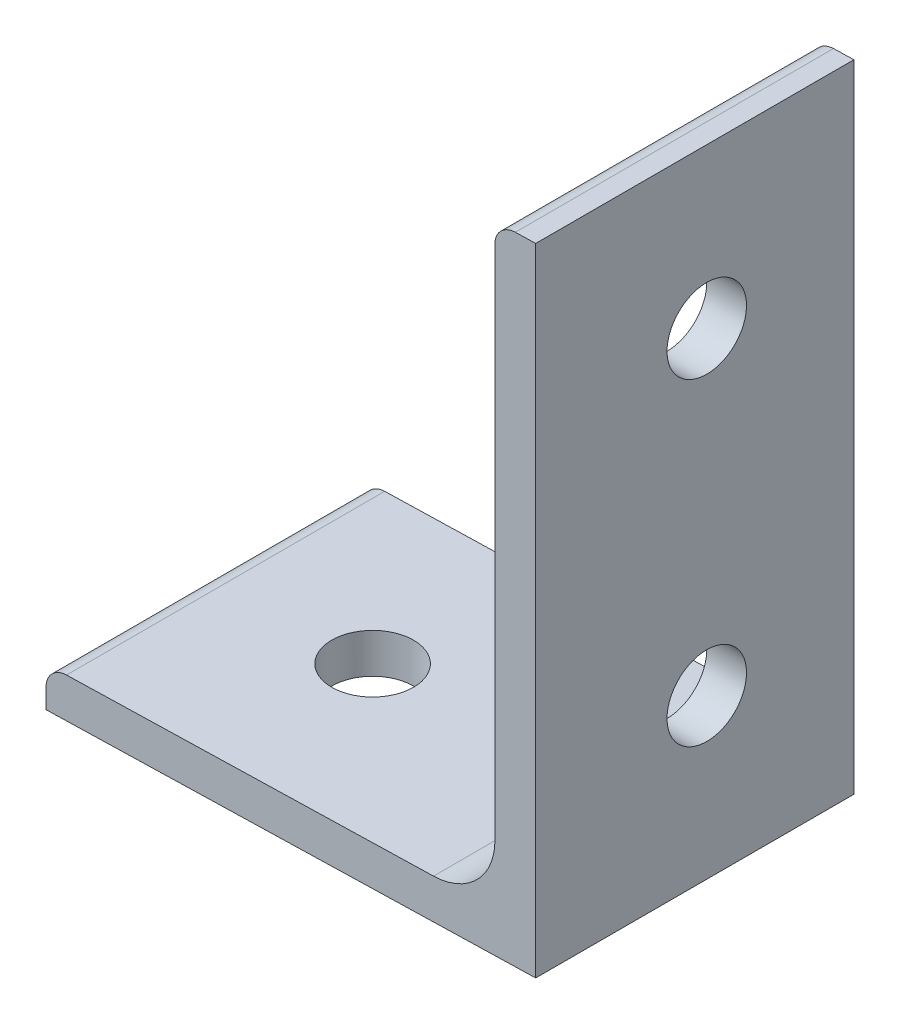
from build123d import *

# Parameters (mm, degrees)
BOSS_EXTRUDE1_DEPTH     = 15.875
SKETCH4_R               = 3.175
CUT_EXTRUDE1_DEPTH      = 49.464271634
SKETCH3_OUTSIDE_W       = 54.3
SKETCH3_OUTSIDE_H       = 47.95
CUT_EXTRUDE2_DEPTH      = 57.529267862
F_1_4_CLEARANCE_HOLE1_D = 6.5278
SKETCH9_R               = 6.35
CUT_EXTRUDE3_DEPTH      = 2.54


with BuildPart() as part:
    # Sketch2 → Boss-Extrude1 (new, symmetric)
    with BuildSketch(Plane.XY):
        with BuildLine():
            Line((-19.05, -25.4), (19.05, -25.4))
            Line((19.05, -25.4), (19.05, 25.4))
            Line((19.05, 25.4), (17.4625, 25.4))
            ThreePointArc((17.4625, 25.4), (16.339967985, 24.935032015), (15.875, 23.8125))
            Line((15.875, 23.8125), (15.875, -17.4498))
            ThreePointArc((15.875, -17.4498), (14.476376302, -20.826376302), (11.0998, -22.225))
            Line((11.0998, -22.225), (-17.4625, -22.225))
            ThreePointArc((-17.4625, -22.225), (-18.585032015, -22.689967985), (-19.05, -23.8125))
            Line((-19.05, -23.8125), (-19.05, -25.4))
        make_face()
    extrude(amount=BOSS_EXTRUDE1_DEPTH, both=True)

    # Sketch4 → Cut-Extrude1 (cut, through all)
    with BuildSketch(Plane(origin=(19.05, 0, 0), x_dir=(0, 0, -1), z_dir=(1, 0, 0))):
        with Locations(Location((3.175, 12.7, 0), (0, 0, 90))):
            Circle(SKETCH4_R)
        with Locations(Location((3.175, -12.7, 0), (0, 0, 90))):
            Circle(SKETCH4_R)
    extrude(amount=-CUT_EXTRUDE1_DEPTH, mode=Mode.SUBTRACT)

    # Sketch3 outside → Cut-Extrude2 (cut, through all)
    with BuildSketch(Plane.XZ.offset(25.4)):
        Rectangle(SKETCH3_OUTSIDE_W, SKETCH3_OUTSIDE_H)
        Polygon((-19.05, -13.926834826), (19.05, -14.924518438), (19.05, 10.484188491), (-19.05, 11.481872103), align=None, mode=Mode.SUBTRACT)
    extrude(amount=-CUT_EXTRUDE2_DEPTH, mode=Mode.SUBTRACT)

    # 1/4 Clearance Hole1 (through all)
    with Locations(Plane(origin=(0, -25.4, 0), x_dir=(-1, 0, 0), z_dir=(0, -1, 0))):
        with Locations((6.021904729, 1.563634042)):
            Hole(F_1_4_CLEARANCE_HOLE1_D / 2)

    # Sketch9 → Cut-Extrude3 (cut)
    with BuildSketch(Plane.ZY.offset(-15.875)):
        with Locations((-3.175, -12.7)):
            Circle(SKETCH9_R)
    extrude(amount=CUT_EXTRUDE3_DEPTH, mode=Mode.SUBTRACT)


solid = part.part
